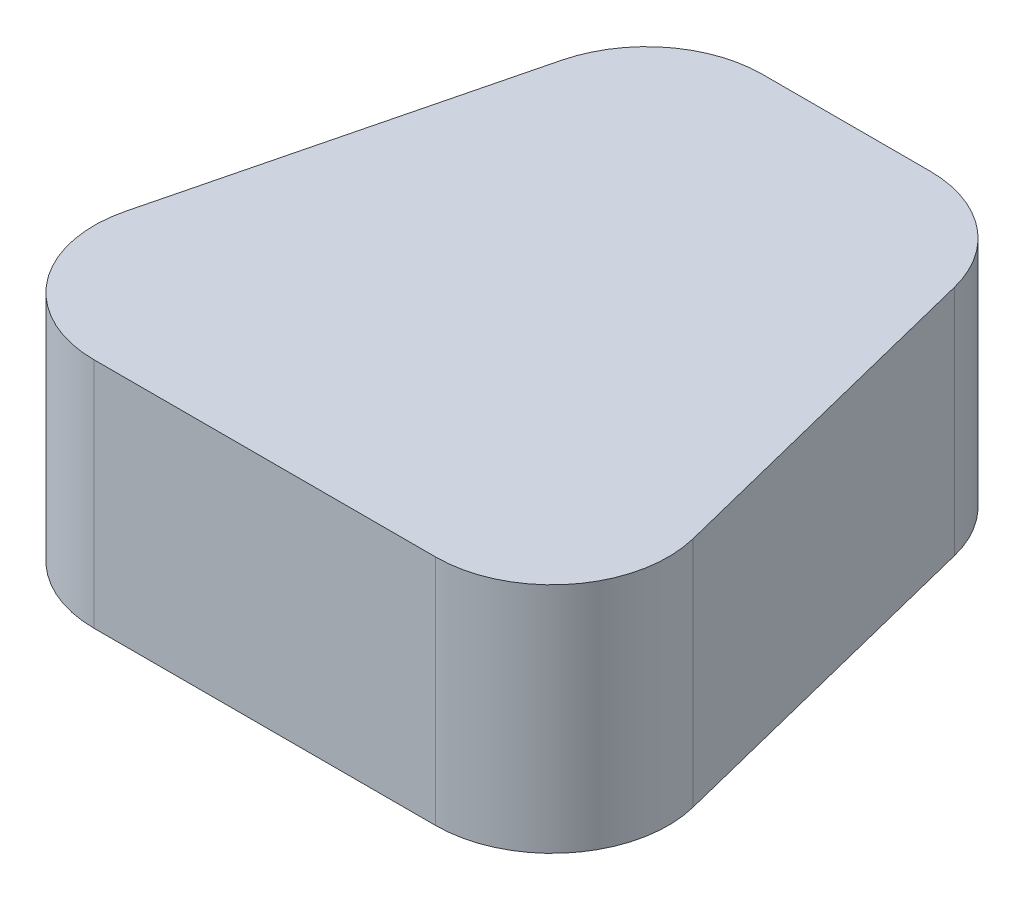
from build123d import *

# Parameters (mm, degrees)
FSHAPE1_DEPTH    = 20
FRSHAPE1_R       = 10
FPIN1ABASE_REACH = 42.935
SPIN1ABASE_R     = 5
FPIN1BBASE_REACH = 42.935
SPIN1BBASE_R     = 5
FPIN2BASE_REACH  = 42.935
SPIN2BASE_R      = 5


with BuildPart() as part:
    # SShape1 → FShape1 (new body)
    with BuildSketch(Plane(origin=(0, 1, 0), x_dir=(1, 0, 0), z_dir=(0, 1, 0))):
        Polygon((-15, 25), (15, 25), (27.5, -25), (-27.5, -25), align=None)
    extrude(amount=FSHAPE1_DEPTH)

    # FRShape1
    frshape1_edges = [part.edges().sort_by_distance(p)[0] for p in [
        (-15, 11, -25),
        (15, 11, -25),
        (27.5, 11, 25),
        (-27.5, 11, 25),
    ]]
    fillet(frshape1_edges, radius=FRSHAPE1_R)

    # SPin1aBase → FPin1aBase (add, up to next)
    with BuildSketch(Plane(origin=(0, 0, 0), x_dir=(1, 0, 0), z_dir=(0, 1, 0)), mode=Mode.PRIVATE) as fpin1abase_sk1:
        with Locations(Location((6.84160069, -3.95, 0), (0, 0, 270))):
            Circle(SPIN1ABASE_R)
    fpin1abase_tool1 = extrude(fpin1abase_sk1.sketch, amount=FPIN1ABASE_REACH, mode=Mode.PRIVATE) - part.part
    add(fpin1abase_tool1.solids().sort_by_distance((6.841601, 0, 3.95))[0])

    # SPin1bBase → FPin1bBase (add, up to next)
    with BuildSketch(Plane(origin=(0, 0, 0), x_dir=(1, 0, 0), z_dir=(0, 1, 0)), mode=Mode.PRIVATE) as fpin1bbase_sk1:
        with Locations(Location((-6.84160069, -3.95, 0), (0, 0, 270))):
            Circle(SPIN1BBASE_R)
    fpin1bbase_tool1 = extrude(fpin1bbase_sk1.sketch, amount=FPIN1BBASE_REACH, mode=Mode.PRIVATE) - part.part
    add(fpin1bbase_tool1.solids().sort_by_distance((-6.841601, 0, 3.95))[0])

    # SPin2Base → FPin2Base (add, up to next)
    with BuildSketch(Plane(origin=(0, 0, 0), x_dir=(1, 0, 0), z_dir=(0, 1, 0)), mode=Mode.PRIVATE) as fpin2base_sk1:
        with Locations(Location((0, 10.3, 0), (0, 0, 270))):
            Circle(SPIN2BASE_R)
    fpin2base_tool1 = extrude(fpin2base_sk1.sketch, amount=FPIN2BASE_REACH, mode=Mode.PRIVATE) - part.part
    add(fpin2base_tool1.solids().sort_by_distance((0, 0, -10.3))[0])


solid = part.part
